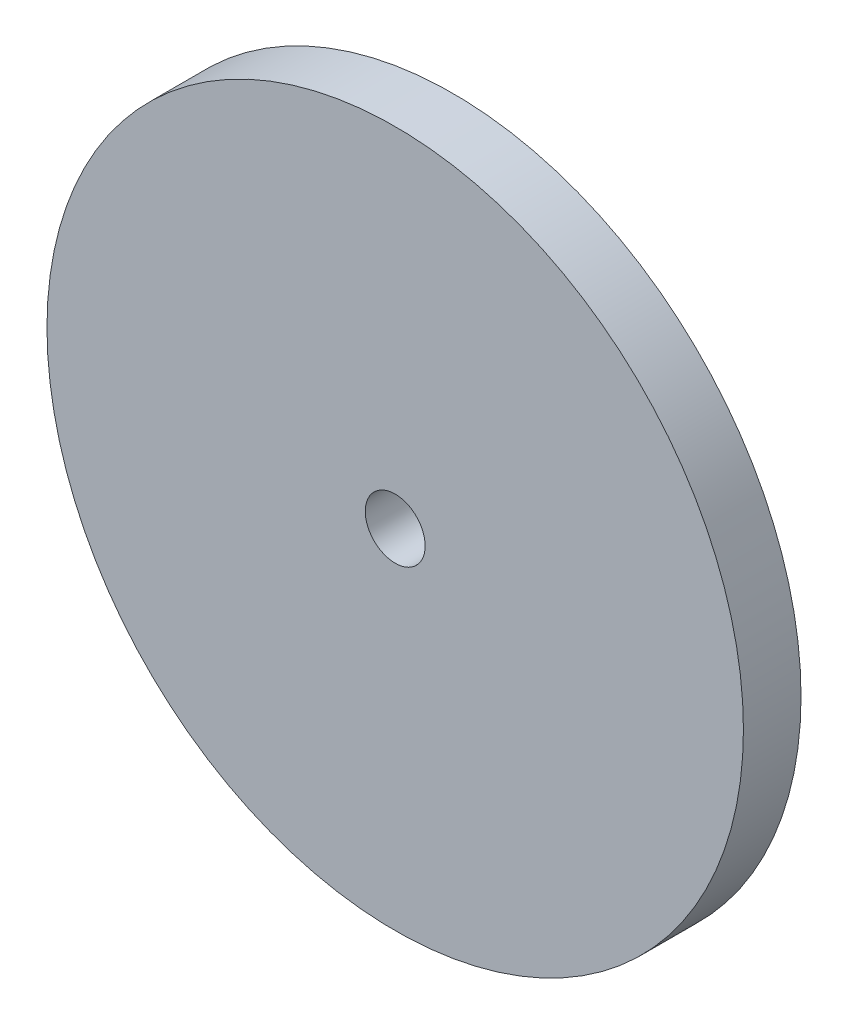
from build123d import *

# Parameters (mm, degrees)
SKETCH1_R           = 19.2
SKETCH1_R_2         = 1.651
BOSS_EXTRUDE1_DEPTH = 3.175
SKETCH2_R           = 6.236054326
BOSS_EXTRUDE2_DEPTH = 3.175


with BuildPart() as part:
    # Sketch1 → Boss-Extrude1 (new body)
    with BuildSketch(Plane.XY):
        Circle(SKETCH1_R)
        Circle(SKETCH1_R_2, mode=Mode.SUBTRACT)
        with BuildLine():
            ThreePointArc((7.62, 3.061054326), (1.383945674, -3.175), (7.62, -9.411054326))
            ThreePointArc((7.62, -9.411054326), (13.856054326, -3.175), (7.62, 3.061054326))
        make_face(mode=Mode.SUBTRACT)
    extrude(amount=BOSS_EXTRUDE1_DEPTH)

    # Sketch2 → Boss-Extrude2 (add)
    with BuildSketch(Plane(origin=(0, 0, 0), x_dir=(-1, 0, 0), z_dir=(0, 0, -1))):
        with Locations((-7.62, -3.175)):
            Circle(SKETCH2_R)
    extrude(amount=-BOSS_EXTRUDE2_DEPTH)


solid = part.part
